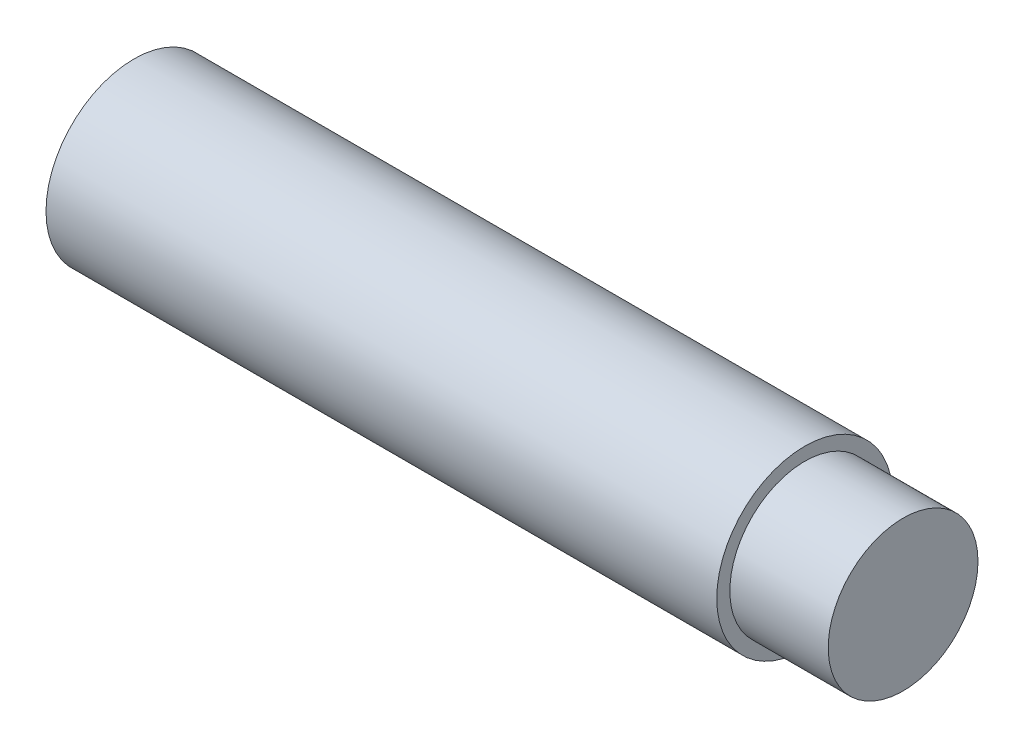
from build123d import *

# Parameters (mm, degrees)
SKETCH1_R           = 3.935
BOSS_EXTRUDE1_DEPTH = 30
SKETCH2_R           = 3.35
BOSS_EXTRUDE2_DEPTH = 4.4


with BuildPart() as part:
    # Sketch1 → Boss-Extrude1 (new body)
    with BuildSketch(Plane(origin=(0, 0, 0), x_dir=(0, 0, -1), z_dir=(1, 0, 0))):
        Circle(SKETCH1_R)
    extrude(amount=BOSS_EXTRUDE1_DEPTH)

    # Sketch2 → Boss-Extrude2 (add)
    with BuildSketch(Plane(origin=(30, 0, 0), x_dir=(0, 0, -1), z_dir=(1, 0, 0))):
        Circle(SKETCH2_R)
    extrude(amount=BOSS_EXTRUDE2_DEPTH)


solid = part.part
